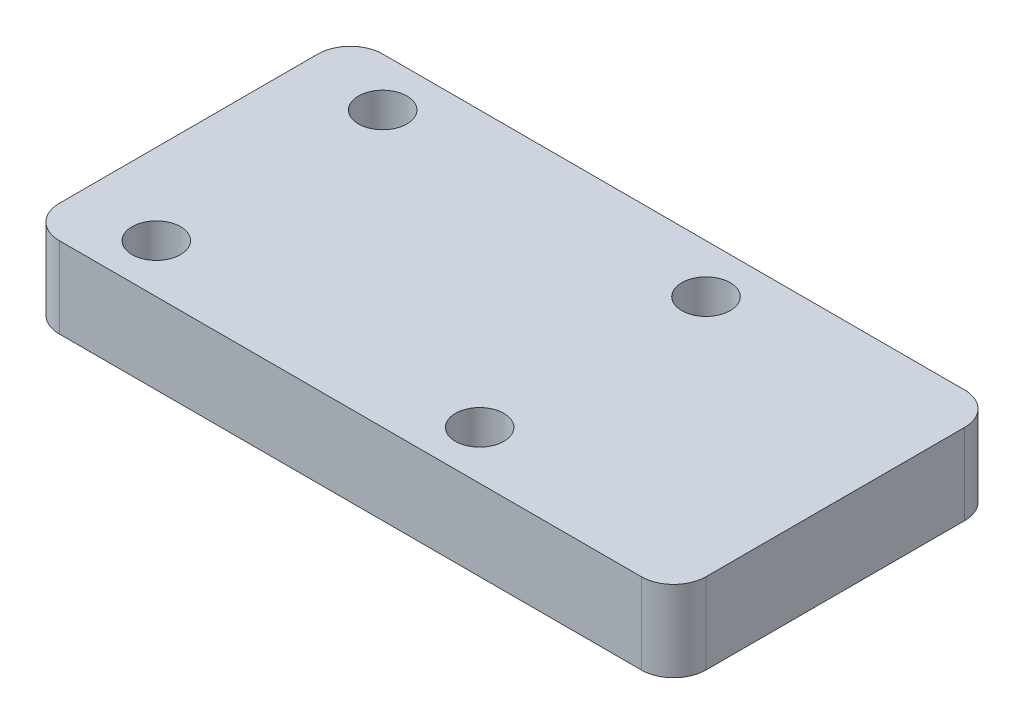
from build123d import *

# Parameters (mm, degrees)
SKETCH_1_W      = 40
SKETCH_1_H      = 20
SKETCH_1_R      = 1.5
EXTRUDE_1_DEPTH = 5
FILLET_1_R      = 2


with BuildPart() as part:
    # 草图1 → 凸台-拉伸1 (new body)
    with BuildSketch(Plane(origin=(0, 0, 0), x_dir=(1, 0, 0), z_dir=(0, 1, 0))):
        with Locations((20, 0)):
            Rectangle(SKETCH_1_W, SKETCH_1_H)
        with Locations(Location((5, -7, 0), (0, 0, 270))):
            Circle(SKETCH_1_R, mode=Mode.SUBTRACT)
        with Locations(Location((25, -7, 0), (0, 0, 270))):
            Circle(SKETCH_1_R, mode=Mode.SUBTRACT)
        with Locations(Location((25, 7, 0), (0, 0, 90))):
            Circle(SKETCH_1_R, mode=Mode.SUBTRACT)
        with Locations(Location((5, 7, 0), (0, 0, 90))):
            Circle(SKETCH_1_R, mode=Mode.SUBTRACT)
    extrude(amount=EXTRUDE_1_DEPTH)

    # 圆角1
    fillet_1_edges = [part.edges().sort_by_distance(p)[0] for p in [
        (0, 2.5, -10),
        (40, 2.5, -10),
        (40, 2.5, 10),
        (0, 2.5, 10),
    ]]
    fillet(fillet_1_edges, radius=FILLET_1_R)


solid = part.part
